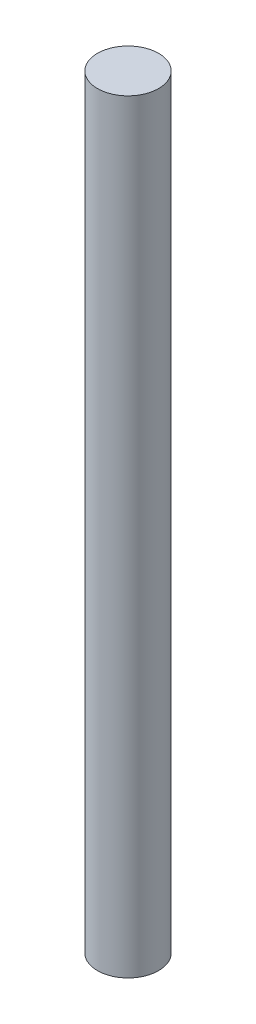
from build123d import *

# Parameters (mm, degrees)
SKETCH1_R           = 6.35
BOSS_EXTRUDE1_DEPTH = 158.75


with BuildPart() as part:
    # Sketch1 → Boss-Extrude1 (new body)
    with BuildSketch(Plane(origin=(0, 0, 0), x_dir=(1, 0, 0), z_dir=(0, 1, 0))):
        with Locations(Location((0, 0, 0), (0, 0, 90))):
            Circle(SKETCH1_R)
    extrude(amount=BOSS_EXTRUDE1_DEPTH)


solid = part.part
